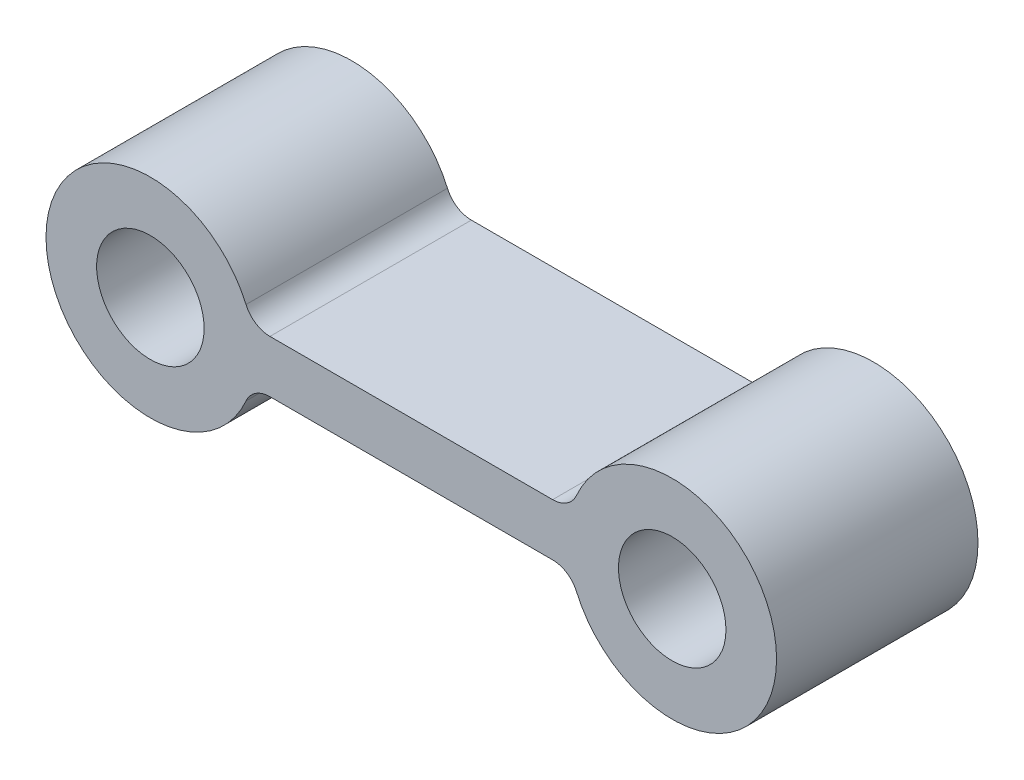
from build123d import *

# Parameters (mm, degrees)
SKETCH1_R          = 6.5405
BASE_EXTRUDE_DEPTH = 24.511


with BuildPart() as part:
    # Sketch1 → Base-Extrude (new body)
    with BuildSketch(Plane.XY):
        with BuildLine():
            Line((17.200322169, 3.175), (-17.200322169, 3.175))
            ThreePointArc((-17.200322169, 3.175), (-18.939341289, 3.693604416), (-20.110257735, 5.08))
            ThreePointArc((-20.110257735, 5.08), (-44.45, 0), (-20.110257735, -5.08))
            ThreePointArc((-20.110257735, -5.08), (-18.939341289, -3.693604416), (-17.200322169, -3.175))
            Line((-17.200322169, -3.175), (17.200322169, -3.175))
            ThreePointArc((17.200322169, -3.175), (18.939341289, -3.693604416), (20.110257735, -5.08))
            ThreePointArc((20.110257735, -5.08), (44.45, 0), (20.110257735, 5.08))
            ThreePointArc((20.110257735, 5.08), (18.939341289, 3.693604416), (17.200322169, 3.175))
        make_face()
        with Locations((31.75, 0)):
            Circle(SKETCH1_R, mode=Mode.SUBTRACT)
        with Locations((-31.75, 0)):
            Circle(SKETCH1_R, mode=Mode.SUBTRACT)
    extrude(amount=BASE_EXTRUDE_DEPTH)


solid = part.part
